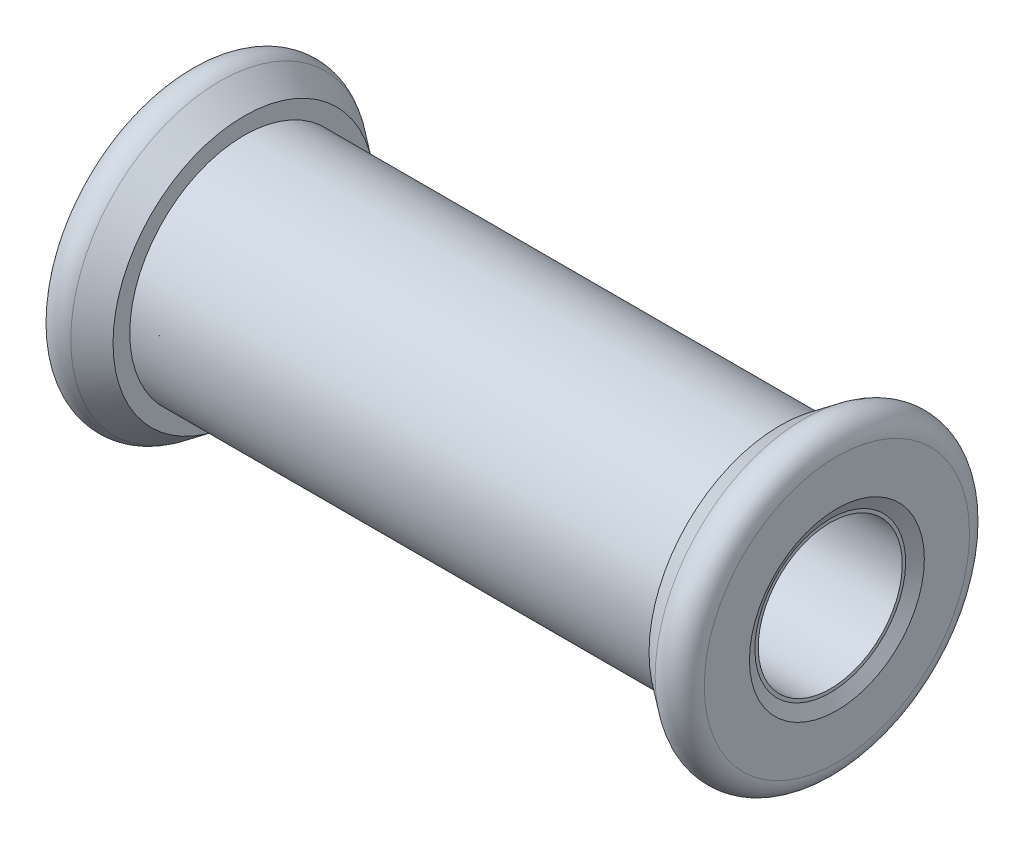
from build123d import *

# Parameters (mm, degrees)
SKETCH4_R          = 2.15
CUT_EXTRUDE1_DEPTH = 28


with BuildPart() as part:
    # Sketch1 → Revolve1 (revolve)
    with BuildSketch(Plane.XY):
        with BuildLine():
            Line((-37.045023651, 0), (-18.045023651, 0))
            Line((-18.045023651, 0), (-18.045023651, 2.25))
            Line((-18.045023651, 2.25), (-17.846575332, 2.610383943))
            Line((-17.846575332, 2.610383943), (-17.846575332, 3.959600078))
            ThreePointArc((-17.846575332, 3.959600078), (-18.183709968, 4.505741021), (-18.823024722, 4.449116479))
            Line((-18.823024722, 4.449116479), (-19.545023651, 3.91))
            Line((-19.545023651, 3.91), (-19.545023651, 3.41))
            Line((-19.545023651, 3.41), (-35.545023651, 3.41))
            Line((-35.545023651, 3.41), (-35.545023651, 3.91))
            Line((-35.545023651, 3.91), (-36.267022579, 4.449116479))
            ThreePointArc((-36.267022579, 4.449116479), (-36.906337333, 4.505741021), (-37.24347197, 3.959600078))
            Line((-37.24347197, 3.959600078), (-37.24347197, 2.610383943))
            Line((-37.24347197, 2.610383943), (-37.045023651, 2.25))
            Line((-37.045023651, 2.25), (-37.045023651, 0))
        make_face()
    revolve(axis=Axis((-9.250519902, 0, 0), (-1, 0, 0)))

    # Sketch4 → Cut-Extrude1 (cut)
    with BuildSketch(Plane(origin=(-18.045023651, 0, 0), x_dir=(0, 0, -1), z_dir=(1, 0, 0))):
        with Locations(Location((0, 0, 0), (0, 0, 90))):
            Circle(SKETCH4_R)
    extrude(amount=-CUT_EXTRUDE1_DEPTH, mode=Mode.SUBTRACT)


solid = part.part
